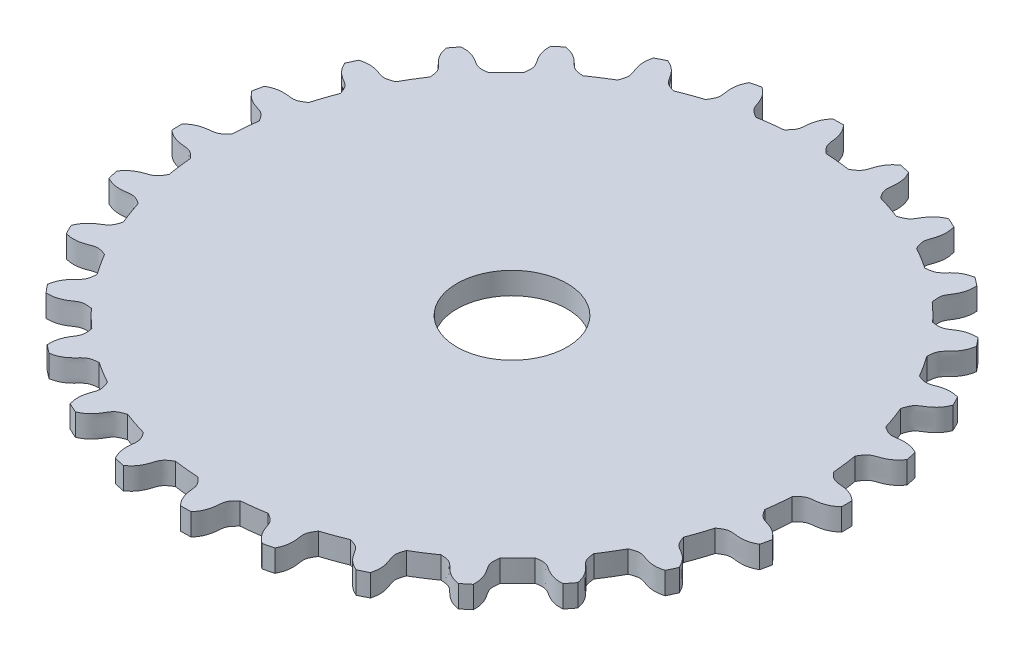
from build123d import *

# Parameters (mm, degrees)
SKETCH1_R          = 30
EXTRUDE1_DEPTH     = 2
SKETCH2_R          = 5
CUT_EXTRUDE1_DEPTH = 43.473521163
CUT_EXTRUDE5_DEPTH = 43.473521163


with BuildPart() as part:
    # Sketch1 → Extrude1 (new body)
    with BuildSketch(Plane(origin=(0, 0, 0), x_dir=(1, 0, 0), z_dir=(0, 1, 0))):
        with Locations(Location((0, 0, 0), (0, 0, 270))):
            Circle(SKETCH1_R)
    extrude(amount=EXTRUDE1_DEPTH)

    # Sketch2 → Cut-Extrude1 (cut, through all)
    with BuildSketch(Plane(origin=(0, 2, 0), x_dir=(1, 0, 0), z_dir=(0, 1, 0))):
        with Locations(Location((0, 0, 0), (0, 0, 270))):
            Circle(SKETCH2_R)
    extrude(amount=-CUT_EXTRUDE1_DEPTH, mode=Mode.SUBTRACT)

    # Sketch3 → Cut-Extrude5 (cut, through all)
    with BuildSketch(Plane(origin=(0, 2, 0), x_dir=(1, 0, 0), z_dir=(0, 1, 0))):
        with BuildLine():
            add(Edge.make_bspline(
                [(-29.430516084, 5.817621766), (-29.309142787, 5.669644661), (-28.948220982, 5.22961242), (-28.198820835, 4.807577089), (-27.21680285, 4.594838684), (-26.899823927, 4.071953357), (-26.73195902, 3.795045052)],
                knots=[0, 0, 0, 0, 0.165712652, 0.492771564, 0.731383232, 1, 1, 1, 1], degree=3))
            ThreePointArc((-29.430516084, 5.817621766), (-29.852879165, 2.967424061), (-29.999865439, 0.089853459))
            add(Edge.make_bspline(
                [(-29.999865439, 0.089853459), (-29.851736682, 0.211041628), (-29.411253482, 0.571412927), (-28.593436526, 0.837664364), (-27.5887554, 0.852921692), (-27.175044904, 1.303175318), (-26.955953133, 1.541619509)],
                knots=[0, 0, 0, 0, 0.165712652, 0.492771564, 0.731383232, 1, 1, 1, 1], degree=3))
            ThreePointArc((-26.955953133, 1.541619509), (-26.867591249, 2.670681655), (-26.73195902, 3.795045052))
        make_face()
        with BuildLine():
            add(Edge.make_bspline(
                [(-27.398088972, 12.220667768), (-27.31268676, 12.049392659), (-27.058730404, 11.540080287), (-26.422030979, 10.961869042), (-25.511972984, 10.535944874), (-25.319294315, 9.955634929), (-25.217256027, 9.648315837)],
                knots=[0, 0, 0, 0, 0.165712652, 0.492771564, 0.731383232, 1, 1, 1, 1], degree=3))
            ThreePointArc((-27.398088972, 12.220667768), (-28.444091184, 9.535915097), (-29.227711903, 6.763198721))
            add(Edge.make_bspline(
                [(-29.227711903, 6.763198721), (-29.056330139, 6.8483867), (-28.546700613, 7.101706005), (-27.690141518, 7.179300571), (-26.70725477, 6.970612783), (-26.203726003, 7.317518365), (-25.937068495, 7.501231757)],
                knots=[0, 0, 0, 0, 0.165712652, 0.492771564, 0.731383232, 1, 1, 1, 1], degree=3))
            ThreePointArc((-25.937068495, 7.501231757), (-25.599682065, 8.582323587), (-25.217256027, 9.648315837))
        make_face()
        with BuildLine():
            add(Edge.make_bspline(
                [(-23.991807273, 18.010918459), (-23.946658571, 17.824933795), (-23.812402095, 17.271880342), (-23.320330161, 16.56648711), (-22.527866263, 15.948734795), (-22.469149562, 15.340099394), (-22.438054518, 15.017779778)],
                knots=[0, 0, 0, 0, 0.165712652, 0.492771564, 0.731383232, 1, 1, 1, 1], degree=3))
            ThreePointArc((-23.991807273, 18.010918459), (-25.608997698, 15.626235532), (-26.989958847, 13.097408959))
            add(Edge.make_bspline(
                [(-26.989958847, 13.097408959), (-26.803917873, 13.142325067), (-26.250696976, 13.27588989), (-25.39834719, 13.160936668), (-24.486540867, 12.738768242), (-23.918442863, 12.964930485), (-23.61759094, 13.084700921)],
                knots=[0, 0, 0, 0, 0.165712652, 0.492771564, 0.731383232, 1, 1, 1, 1], degree=3))
            ThreePointArc((-23.61759094, 13.084700921), (-23.048097928, 14.063611979), (-22.438054518, 15.017779778))
        make_face()
        with BuildLine():
            add(Edge.make_bspline(
                [(-19.382476178, 22.898026492), (-19.379844929, 22.70665832), (-19.372020514, 22.137596195), (-19.049250611, 21.340392337), (-18.41411826, 20.561788556), (-18.492307827, 19.95534722), (-18.533715263, 19.634189532)],
                knots=[0, 0, 0, 0, 0.165712652, 0.492771564, 0.731383232, 1, 1, 1, 1], degree=3))
            ThreePointArc((-19.382476178, 22.898026492), (-21.489762134, 20.932991268), (-23.398816555, 18.774860421))
            add(Edge.make_bspline(
                [(-23.398816555, 18.774860421), (-23.207445242, 18.777252378), (-22.638373778, 18.784365221), (-21.832973679, 18.482628446), (-21.037969557, 17.868148669), (-20.433789122, 17.962226854), (-20.113828757, 18.012048544)],
                knots=[0, 0, 0, 0, 0.165712652, 0.492771564, 0.731383232, 1, 1, 1, 1], degree=3))
            ThreePointArc((-20.113828757, 18.012048544), (-19.340785921, 18.839692141), (-18.533715263, 19.634189532))
        make_face()
        with BuildLine():
            ThreePointArc((-15.601475211, 22.036196842), (-14.663646147, 22.671071472), (-13.700018134, 23.266059037))
            add(Edge.make_bspline(
                [(-13.801226792, 26.636931862), (-13.841244939, 26.449776182), (-13.960244933, 25.893240537), (-13.822962093, 25.044201184), (-13.377009477, 24.143788381), (-13.58818456, 23.569950611), (-13.700018134, 23.266059037)],
                knots=[0, 0, 0, 0, 0.165712652, 0.492771564, 0.731383232, 1, 1, 1, 1], degree=3))
            ThreePointArc((-13.801226792, 26.636931862), (-16.292940163, 25.190079413), (-18.634359895, 23.510861985))
            add(Edge.make_bspline(
                [(-18.634359895, 23.510861985), (-18.447254401, 23.470609847), (-17.89086799, 23.350914043), (-17.172803702, 22.877524057), (-16.534466607, 22.10154551), (-15.924499872, 22.058822164), (-15.601475211, 22.036196842)],
                knots=[0, 0, 0, 0, 0.165712652, 0.492771564, 0.731383232, 1, 1, 1, 1], degree=3))
        make_face()
        with BuildLine():
            ThreePointArc((-7.527926266, 29.040150243), (-10.279122139, 28.184031792), (-12.935498621, 27.067930756))
            add(Edge.make_bspline(
                [(-12.935498621, 27.067930756), (-12.762041195, 26.987052934), (-12.246239375, 26.74655053), (-11.65151764, 26.125245083), (-11.201856459, 25.226678572), (-10.616689702, 25.049296022), (-10.306798552, 24.955358214)],
                knots=[0, 0, 0, 0, 0.165712652, 0.492771564, 0.731383232, 1, 1, 1, 1], degree=3))
            ThreePointArc((-10.306798552, 24.955358214), (-9.251209925, 25.365628613), (-8.17934489, 25.731271192))
            add(Edge.make_bspline(
                [(-7.527926266, 29.040150243), (-7.608587131, 28.866591821), (-7.848444379, 28.350489677), (-7.903532536, 27.492189207), (-7.669121581, 26.515117841), (-8.002692981, 26.002658258), (-8.17934489, 25.731271192)],
                knots=[0, 0, 0, 0, 0.165712652, 0.492771564, 0.731383232, 1, 1, 1, 1], degree=3))
        make_face()
        with BuildLine():
            ThreePointArc((-0.877144083, 29.987174229), (-3.749866009, 29.76471913), (-6.587997431, 29.267700454))
            add(Edge.make_bspline(
                [(-6.587997431, 29.267700454), (-6.436885953, 29.150252499), (-5.987533182, 28.80100329), (-5.545975831, 28.062937231), (-5.307538454, 27.086840633), (-4.77651438, 26.783693581), (-4.495295977, 26.623153722)],
                knots=[0, 0, 0, 0, 0.165712652, 0.492771564, 0.731383232, 1, 1, 1, 1], degree=3))
            ThreePointArc((-4.495295977, 26.623153722), (-3.374879408, 26.788247217), (-2.248525139, 26.906209965))
            add(Edge.make_bspline(
                [(-0.877144083, 29.987174229), (-0.994402994, 29.835916011), (-1.343090051, 29.386126883), (-1.587786855, 28.561604067), (-1.576671905, 27.556868575), (-2.015912958, 27.131484043), (-2.248525139, 26.906209965)],
                knots=[0, 0, 0, 0, 0.165712652, 0.492771564, 0.731383232, 1, 1, 1, 1], degree=3))
        make_face()
        with BuildLine():
            ThreePointArc((5.817621766, 29.430516084), (2.967424061, 29.852879165), (0.089853459, 29.999865439))
            add(Edge.make_bspline(
                [(0.089853459, 29.999865439), (0.211041628, 29.851736682), (0.571412927, 29.411253482), (0.837664364, 28.593436526), (0.852921692, 27.5887554), (1.303175318, 27.175044904), (1.541619509, 26.955953133)],
                knots=[0, 0, 0, 0, 0.165712652, 0.492771564, 0.731383232, 1, 1, 1, 1], degree=3))
            ThreePointArc((1.541619509, 26.955953133), (2.670681655, 26.867591249), (3.795045052, 26.73195902))
            add(Edge.make_bspline(
                [(5.817621766, 29.430516084), (5.669644661, 29.309142787), (5.22961242, 28.948220982), (4.807577089, 28.198820835), (4.594838684, 27.21680285), (4.071953357, 26.899823927), (3.795045052, 26.73195902)],
                knots=[0, 0, 0, 0, 0.165712652, 0.492771564, 0.731383232, 1, 1, 1, 1], degree=3))
        make_face()
        with BuildLine():
            ThreePointArc((12.220667768, 27.398088972), (9.535915097, 28.444091184), (6.763198721, 29.227711903))
            add(Edge.make_bspline(
                [(6.763198721, 29.227711903), (6.8483867, 29.056330139), (7.101706005, 28.546700613), (7.179300571, 27.690141518), (6.970612783, 26.70725477), (7.317518365, 26.203726003), (7.501231757, 25.937068495)],
                knots=[0, 0, 0, 0, 0.165712652, 0.492771564, 0.731383232, 1, 1, 1, 1], degree=3))
            ThreePointArc((7.501231757, 25.937068495), (8.582323587, 25.599682065), (9.648315837, 25.217256027))
            add(Edge.make_bspline(
                [(12.220667768, 27.398088972), (12.049392659, 27.31268676), (11.540080287, 27.058730404), (10.961869042, 26.422030979), (10.535944874, 25.511972984), (9.955634929, 25.319294315), (9.648315837, 25.217256027)],
                knots=[0, 0, 0, 0, 0.165712652, 0.492771564, 0.731383232, 1, 1, 1, 1], degree=3))
        make_face()
        with BuildLine():
            ThreePointArc((18.010918459, 23.991807273), (15.626235532, 25.608997698), (13.097408959, 26.989958847))
            add(Edge.make_bspline(
                [(13.097408959, 26.989958847), (13.142325067, 26.803917873), (13.27588989, 26.250696976), (13.160936668, 25.39834719), (12.738768242, 24.486540867), (12.964930485, 23.918442863), (13.084700921, 23.61759094)],
                knots=[0, 0, 0, 0, 0.165712652, 0.492771564, 0.731383232, 1, 1, 1, 1], degree=3))
            ThreePointArc((13.084700921, 23.61759094), (14.063611979, 23.048097928), (15.017779778, 22.438054518))
            add(Edge.make_bspline(
                [(18.010918459, 23.991807273), (17.824933795, 23.946658571), (17.271880342, 23.812402095), (16.56648711, 23.320330161), (15.948734795, 22.527866263), (15.340099394, 22.469149562), (15.017779778, 22.438054518)],
                knots=[0, 0, 0, 0, 0.165712652, 0.492771564, 0.731383232, 1, 1, 1, 1], degree=3))
        make_face()
        with BuildLine():
            ThreePointArc((22.898026492, 19.382476178), (20.932991268, 21.489762134), (18.774860421, 23.398816555))
            add(Edge.make_bspline(
                [(18.774860421, 23.398816555), (18.777252378, 23.207445242), (18.784365221, 22.638373778), (18.482628446, 21.832973679), (17.868148669, 21.037969557), (17.962226854, 20.433789122), (18.012048544, 20.113828757)],
                knots=[0, 0, 0, 0, 0.165712652, 0.492771564, 0.731383232, 1, 1, 1, 1], degree=3))
            ThreePointArc((18.012048544, 20.113828757), (18.839692141, 19.340785921), (19.634189532, 18.533715263))
            add(Edge.make_bspline(
                [(22.898026492, 19.382476178), (22.70665832, 19.379844929), (22.137596195, 19.372020514), (21.340392337, 19.049250611), (20.561788556, 18.41411826), (19.95534722, 18.492307827), (19.634189532, 18.533715263)],
                knots=[0, 0, 0, 0, 0.165712652, 0.492771564, 0.731383232, 1, 1, 1, 1], degree=3))
        make_face()
        with BuildLine():
            ThreePointArc((26.636931862, 13.801226792), (25.190079413, 16.292940163), (23.510861985, 18.634359895))
            add(Edge.make_bspline(
                [(23.510861985, 18.634359895), (23.470609847, 18.447254401), (23.350914043, 17.89086799), (22.877524057, 17.172803702), (22.10154551, 16.534466607), (22.058822164, 15.924499872), (22.036196842, 15.601475211)],
                knots=[0, 0, 0, 0, 0.165712652, 0.492771564, 0.731383232, 1, 1, 1, 1], degree=3))
            ThreePointArc((22.036196842, 15.601475211), (22.671071472, 14.663646147), (23.266059037, 13.700018134))
            add(Edge.make_bspline(
                [(26.636931862, 13.801226792), (26.449776182, 13.841244939), (25.893240537, 13.960244933), (25.044201184, 13.822962093), (24.143788381, 13.377009477), (23.569950611, 13.58818456), (23.266059037, 13.700018134)],
                knots=[0, 0, 0, 0, 0.165712652, 0.492771564, 0.731383232, 1, 1, 1, 1], degree=3))
        make_face()
        with BuildLine():
            ThreePointArc((29.040150243, 7.527926266), (28.184031792, 10.279122139), (27.067930756, 12.935498621))
            add(Edge.make_bspline(
                [(27.067930756, 12.935498621), (26.987052934, 12.762041195), (26.74655053, 12.246239375), (26.125245083, 11.65151764), (25.226678572, 11.201856459), (25.049296022, 10.616689702), (24.955358214, 10.306798552)],
                knots=[0, 0, 0, 0, 0.165712652, 0.492771564, 0.731383232, 1, 1, 1, 1], degree=3))
            ThreePointArc((24.955358214, 10.306798552), (25.365628613, 9.251209925), (25.731271192, 8.17934489))
            add(Edge.make_bspline(
                [(29.040150243, 7.527926266), (28.866591821, 7.608587131), (28.350489677, 7.848444379), (27.492189207, 7.903532536), (26.515117841, 7.669121581), (26.002658258, 8.002692981), (25.731271192, 8.17934489)],
                knots=[0, 0, 0, 0, 0.165712652, 0.492771564, 0.731383232, 1, 1, 1, 1], degree=3))
        make_face()
        with BuildLine():
            ThreePointArc((29.987174229, 0.877144083), (29.76471913, 3.749866009), (29.267700454, 6.587997431))
            add(Edge.make_bspline(
                [(29.267700454, 6.587997431), (29.150252499, 6.436885953), (28.80100329, 5.987533182), (28.062937231, 5.545975831), (27.086840633, 5.307538454), (26.783693581, 4.77651438), (26.623153722, 4.495295977)],
                knots=[0, 0, 0, 0, 0.165712652, 0.492771564, 0.731383232, 1, 1, 1, 1], degree=3))
            ThreePointArc((26.623153722, 4.495295977), (26.788247217, 3.374879408), (26.906209965, 2.248525139))
            add(Edge.make_bspline(
                [(29.987174229, 0.877144083), (29.835916011, 0.994402994), (29.386126883, 1.343090051), (28.561604067, 1.587786855), (27.556868575, 1.576671905), (27.131484043, 2.015912958), (26.906209965, 2.248525139)],
                knots=[0, 0, 0, 0, 0.165712652, 0.492771564, 0.731383232, 1, 1, 1, 1], degree=3))
        make_face()
        with BuildLine():
            ThreePointArc((29.430516084, -5.817621766), (29.852879165, -2.967424061), (29.999865439, -0.089853459))
            add(Edge.make_bspline(
                [(29.999865439, -0.089853459), (29.851736682, -0.211041628), (29.411253482, -0.571412927), (28.593436526, -0.837664364), (27.5887554, -0.852921692), (27.175044904, -1.303175318), (26.955953133, -1.541619509)],
                knots=[0, 0, 0, 0, 0.165712652, 0.492771564, 0.731383232, 1, 1, 1, 1], degree=3))
            ThreePointArc((26.955953133, -1.541619509), (26.867591249, -2.670681655), (26.73195902, -3.795045052))
            add(Edge.make_bspline(
                [(29.430516084, -5.817621766), (29.309142787, -5.669644661), (28.948220982, -5.22961242), (28.198820835, -4.807577089), (27.21680285, -4.594838684), (26.899823927, -4.071953357), (26.73195902, -3.795045052)],
                knots=[0, 0, 0, 0, 0.165712652, 0.492771564, 0.731383232, 1, 1, 1, 1], degree=3))
        make_face()
        with BuildLine():
            ThreePointArc((27.398088972, -12.220667768), (28.444091184, -9.535915097), (29.227711903, -6.763198721))
            add(Edge.make_bspline(
                [(29.227711903, -6.763198721), (29.056330139, -6.8483867), (28.546700613, -7.101706005), (27.690141518, -7.179300571), (26.70725477, -6.970612783), (26.203726003, -7.317518365), (25.937068495, -7.501231757)],
                knots=[0, 0, 0, 0, 0.165712652, 0.492771564, 0.731383232, 1, 1, 1, 1], degree=3))
            ThreePointArc((25.937068495, -7.501231757), (25.599682065, -8.582323587), (25.217256027, -9.648315837))
            add(Edge.make_bspline(
                [(27.398088972, -12.220667768), (27.31268676, -12.049392659), (27.058730404, -11.540080287), (26.422030979, -10.961869042), (25.511972984, -10.535944874), (25.319294315, -9.955634929), (25.217256027, -9.648315837)],
                knots=[0, 0, 0, 0, 0.165712652, 0.492771564, 0.731383232, 1, 1, 1, 1], degree=3))
        make_face()
        with BuildLine():
            ThreePointArc((23.991807273, -18.010918459), (25.608997698, -15.626235532), (26.989958847, -13.097408959))
            add(Edge.make_bspline(
                [(26.989958847, -13.097408959), (26.803917873, -13.142325067), (26.250696976, -13.27588989), (25.39834719, -13.160936668), (24.486540867, -12.738768242), (23.918442863, -12.964930485), (23.61759094, -13.084700921)],
                knots=[0, 0, 0, 0, 0.165712652, 0.492771564, 0.731383232, 1, 1, 1, 1], degree=3))
            ThreePointArc((23.61759094, -13.084700921), (23.048097928, -14.063611979), (22.438054518, -15.017779778))
            add(Edge.make_bspline(
                [(23.991807273, -18.010918459), (23.946658571, -17.824933795), (23.812402095, -17.271880342), (23.320330161, -16.56648711), (22.527866263, -15.948734795), (22.469149562, -15.340099394), (22.438054518, -15.017779778)],
                knots=[0, 0, 0, 0, 0.165712652, 0.492771564, 0.731383232, 1, 1, 1, 1], degree=3))
        make_face()
        with BuildLine():
            ThreePointArc((19.382476178, -22.898026492), (21.489762134, -20.932991268), (23.398816555, -18.774860421))
            add(Edge.make_bspline(
                [(23.398816555, -18.774860421), (23.207445242, -18.777252378), (22.638373778, -18.784365221), (21.832973679, -18.482628446), (21.037969557, -17.868148669), (20.433789122, -17.962226854), (20.113828757, -18.012048544)],
                knots=[0, 0, 0, 0, 0.165712652, 0.492771564, 0.731383232, 1, 1, 1, 1], degree=3))
            ThreePointArc((20.113828757, -18.012048544), (19.340785921, -18.839692141), (18.533715263, -19.634189532))
            add(Edge.make_bspline(
                [(19.382476178, -22.898026492), (19.379844929, -22.70665832), (19.372020514, -22.137596195), (19.049250611, -21.340392337), (18.41411826, -20.561788556), (18.492307827, -19.95534722), (18.533715263, -19.634189532)],
                knots=[0, 0, 0, 0, 0.165712652, 0.492771564, 0.731383232, 1, 1, 1, 1], degree=3))
        make_face()
        with BuildLine():
            add(Edge.make_bspline(
                [(13.801226792, -26.636931862), (13.841244939, -26.449776182), (13.960244933, -25.893240537), (13.822962093, -25.044201184), (13.377009477, -24.143788381), (13.58818456, -23.569950611), (13.700018134, -23.266059037)],
                knots=[0, 0, 0, 0, 0.165712652, 0.492771564, 0.731383232, 1, 1, 1, 1], degree=3))
            ThreePointArc((13.801226792, -26.636931862), (16.292940163, -25.190079413), (18.634359895, -23.510861985))
            add(Edge.make_bspline(
                [(18.634359895, -23.510861985), (18.447254401, -23.470609847), (17.89086799, -23.350914043), (17.172803702, -22.877524057), (16.534466607, -22.10154551), (15.924499872, -22.058822164), (15.601475211, -22.036196842)],
                knots=[0, 0, 0, 0, 0.165712652, 0.492771564, 0.731383232, 1, 1, 1, 1], degree=3))
            ThreePointArc((15.601475211, -22.036196842), (14.663646147, -22.671071472), (13.700018134, -23.266059037))
        make_face()
        with BuildLine():
            add(Edge.make_bspline(
                [(7.527926266, -29.040150243), (7.608587131, -28.866591821), (7.848444379, -28.350489677), (7.903532536, -27.492189207), (7.669121581, -26.515117841), (8.002692981, -26.002658258), (8.17934489, -25.731271192)],
                knots=[0, 0, 0, 0, 0.165712652, 0.492771564, 0.731383232, 1, 1, 1, 1], degree=3))
            ThreePointArc((7.527926266, -29.040150243), (10.279122139, -28.184031792), (12.935498621, -27.067930756))
            add(Edge.make_bspline(
                [(12.935498621, -27.067930756), (12.762041195, -26.987052934), (12.246239375, -26.74655053), (11.65151764, -26.125245083), (11.201856459, -25.226678572), (10.616689702, -25.049296022), (10.306798552, -24.955358214)],
                knots=[0, 0, 0, 0, 0.165712652, 0.492771564, 0.731383232, 1, 1, 1, 1], degree=3))
            ThreePointArc((10.306798552, -24.955358214), (9.251209925, -25.365628613), (8.17934489, -25.731271192))
        make_face()
        with BuildLine():
            add(Edge.make_bspline(
                [(0.877144083, -29.987174229), (0.994402994, -29.835916011), (1.343090051, -29.386126883), (1.587786855, -28.561604067), (1.576671905, -27.556868575), (2.015912958, -27.131484043), (2.248525139, -26.906209965)],
                knots=[0, 0, 0, 0, 0.165712652, 0.492771564, 0.731383232, 1, 1, 1, 1], degree=3))
            ThreePointArc((0.877144083, -29.987174229), (3.749866009, -29.76471913), (6.587997431, -29.267700454))
            add(Edge.make_bspline(
                [(6.587997431, -29.267700454), (6.436885953, -29.150252499), (5.987533182, -28.80100329), (5.545975831, -28.062937231), (5.307538454, -27.086840633), (4.77651438, -26.783693581), (4.495295977, -26.623153722)],
                knots=[0, 0, 0, 0, 0.165712652, 0.492771564, 0.731383232, 1, 1, 1, 1], degree=3))
            ThreePointArc((4.495295977, -26.623153722), (3.374879408, -26.788247217), (2.248525139, -26.906209965))
        make_face()
        with BuildLine():
            add(Edge.make_bspline(
                [(-5.817621766, -29.430516084), (-5.669644661, -29.309142787), (-5.22961242, -28.948220982), (-4.807577089, -28.198820835), (-4.594838684, -27.21680285), (-4.071953357, -26.899823927), (-3.795045052, -26.73195902)],
                knots=[0, 0, 0, 0, 0.165712652, 0.492771564, 0.731383232, 1, 1, 1, 1], degree=3))
            ThreePointArc((-5.817621766, -29.430516084), (-2.967424061, -29.852879165), (-0.089853459, -29.999865439))
            add(Edge.make_bspline(
                [(-0.089853459, -29.999865439), (-0.211041628, -29.851736682), (-0.571412927, -29.411253482), (-0.837664364, -28.593436526), (-0.852921692, -27.5887554), (-1.303175318, -27.175044904), (-1.541619509, -26.955953133)],
                knots=[0, 0, 0, 0, 0.165712652, 0.492771564, 0.731383232, 1, 1, 1, 1], degree=3))
            ThreePointArc((-1.541619509, -26.955953133), (-2.670681655, -26.867591249), (-3.795045052, -26.73195902))
        make_face()
        with BuildLine():
            add(Edge.make_bspline(
                [(-12.220667768, -27.398088972), (-12.049392659, -27.31268676), (-11.540080287, -27.058730404), (-10.961869042, -26.422030979), (-10.535944874, -25.511972984), (-9.955634929, -25.319294315), (-9.648315837, -25.217256027)],
                knots=[0, 0, 0, 0, 0.165712652, 0.492771564, 0.731383232, 1, 1, 1, 1], degree=3))
            ThreePointArc((-12.220667768, -27.398088972), (-9.535915097, -28.444091184), (-6.763198721, -29.227711903))
            add(Edge.make_bspline(
                [(-6.763198721, -29.227711903), (-6.8483867, -29.056330139), (-7.101706005, -28.546700613), (-7.179300571, -27.690141518), (-6.970612783, -26.70725477), (-7.317518365, -26.203726003), (-7.501231757, -25.937068495)],
                knots=[0, 0, 0, 0, 0.165712652, 0.492771564, 0.731383232, 1, 1, 1, 1], degree=3))
            ThreePointArc((-7.501231757, -25.937068495), (-8.582323587, -25.599682065), (-9.648315837, -25.217256027))
        make_face()
        with BuildLine():
            add(Edge.make_bspline(
                [(-18.010918459, -23.991807273), (-17.824933795, -23.946658571), (-17.271880342, -23.812402095), (-16.56648711, -23.320330161), (-15.948734795, -22.527866263), (-15.340099394, -22.469149562), (-15.017779778, -22.438054518)],
                knots=[0, 0, 0, 0, 0.165712652, 0.492771564, 0.731383232, 1, 1, 1, 1], degree=3))
            ThreePointArc((-18.010918459, -23.991807273), (-15.626235532, -25.608997698), (-13.097408959, -26.989958847))
            add(Edge.make_bspline(
                [(-13.097408959, -26.989958847), (-13.142325067, -26.803917873), (-13.27588989, -26.250696976), (-13.160936668, -25.39834719), (-12.738768242, -24.486540867), (-12.964930485, -23.918442863), (-13.084700921, -23.61759094)],
                knots=[0, 0, 0, 0, 0.165712652, 0.492771564, 0.731383232, 1, 1, 1, 1], degree=3))
            ThreePointArc((-13.084700921, -23.61759094), (-14.063611979, -23.048097928), (-15.017779778, -22.438054518))
        make_face()
        with BuildLine():
            add(Edge.make_bspline(
                [(-22.898026492, -19.382476178), (-22.70665832, -19.379844929), (-22.137596195, -19.372020514), (-21.340392337, -19.049250611), (-20.561788556, -18.41411826), (-19.95534722, -18.492307827), (-19.634189532, -18.533715263)],
                knots=[0, 0, 0, 0, 0.165712652, 0.492771564, 0.731383232, 1, 1, 1, 1], degree=3))
            ThreePointArc((-22.898026492, -19.382476178), (-20.932991268, -21.489762134), (-18.774860421, -23.398816555))
            add(Edge.make_bspline(
                [(-18.774860421, -23.398816555), (-18.777252378, -23.207445242), (-18.784365221, -22.638373778), (-18.482628446, -21.832973679), (-17.868148669, -21.037969557), (-17.962226854, -20.433789122), (-18.012048544, -20.113828757)],
                knots=[0, 0, 0, 0, 0.165712652, 0.492771564, 0.731383232, 1, 1, 1, 1], degree=3))
            ThreePointArc((-18.012048544, -20.113828757), (-18.839692141, -19.340785921), (-19.634189532, -18.533715263))
        make_face()
        with BuildLine():
            add(Edge.make_bspline(
                [(-26.636931862, -13.801226792), (-26.449776182, -13.841244939), (-25.893240537, -13.960244933), (-25.044201184, -13.822962093), (-24.143788381, -13.377009477), (-23.569950611, -13.58818456), (-23.266059037, -13.700018134)],
                knots=[0, 0, 0, 0, 0.165712652, 0.492771564, 0.731383232, 1, 1, 1, 1], degree=3))
            ThreePointArc((-26.636931862, -13.801226792), (-25.190079413, -16.292940163), (-23.510861985, -18.634359895))
            add(Edge.make_bspline(
                [(-23.510861985, -18.634359895), (-23.470609847, -18.447254401), (-23.350914043, -17.89086799), (-22.877524057, -17.172803702), (-22.10154551, -16.534466607), (-22.058822164, -15.924499872), (-22.036196842, -15.601475211)],
                knots=[0, 0, 0, 0, 0.165712652, 0.492771564, 0.731383232, 1, 1, 1, 1], degree=3))
            ThreePointArc((-22.036196842, -15.601475211), (-22.671071472, -14.663646147), (-23.266059037, -13.700018134))
        make_face()
        with BuildLine():
            add(Edge.make_bspline(
                [(-29.040150243, -7.527926266), (-28.866591821, -7.608587131), (-28.350489677, -7.848444379), (-27.492189207, -7.903532536), (-26.515117841, -7.669121581), (-26.002658258, -8.002692981), (-25.731271192, -8.17934489)],
                knots=[0, 0, 0, 0, 0.165712652, 0.492771564, 0.731383232, 1, 1, 1, 1], degree=3))
            ThreePointArc((-29.040150243, -7.527926266), (-28.184031792, -10.279122139), (-27.067930756, -12.935498621))
            add(Edge.make_bspline(
                [(-27.067930756, -12.935498621), (-26.987052934, -12.762041195), (-26.74655053, -12.246239375), (-26.125245083, -11.65151764), (-25.226678572, -11.201856459), (-25.049296022, -10.616689702), (-24.955358214, -10.306798552)],
                knots=[0, 0, 0, 0, 0.165712652, 0.492771564, 0.731383232, 1, 1, 1, 1], degree=3))
            ThreePointArc((-24.955358214, -10.306798552), (-25.365628613, -9.251209925), (-25.731271192, -8.17934489))
        make_face()
        with BuildLine():
            add(Edge.make_bspline(
                [(-29.987174229, -0.877144083), (-29.835916011, -0.994402994), (-29.386126883, -1.343090051), (-28.561604067, -1.587786855), (-27.556868575, -1.576671905), (-27.131484043, -2.015912958), (-26.906209965, -2.248525139)],
                knots=[0, 0, 0, 0, 0.165712652, 0.492771564, 0.731383232, 1, 1, 1, 1], degree=3))
            ThreePointArc((-29.987174229, -0.877144083), (-29.76471913, -3.749866009), (-29.267700454, -6.587997431))
            add(Edge.make_bspline(
                [(-29.267700454, -6.587997431), (-29.150252499, -6.436885953), (-28.80100329, -5.987533182), (-28.062937231, -5.545975831), (-27.086840633, -5.307538454), (-26.783693581, -4.77651438), (-26.623153722, -4.495295977)],
                knots=[0, 0, 0, 0, 0.165712652, 0.492771564, 0.731383232, 1, 1, 1, 1], degree=3))
            ThreePointArc((-26.623153722, -4.495295977), (-26.788247217, -3.374879408), (-26.906209965, -2.248525139))
        make_face()
    extrude(amount=-CUT_EXTRUDE5_DEPTH, mode=Mode.SUBTRACT)


solid = part.part
